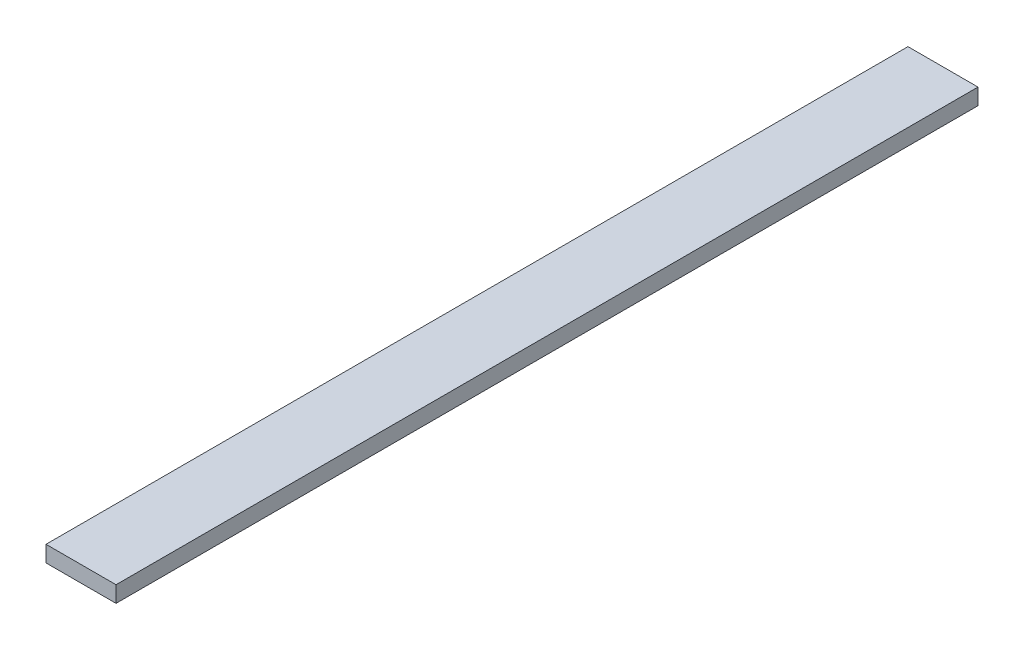
from build123d import *

# Parameters (mm, degrees)
SKETCH1_W           = 41.275
SKETCH1_H           = 9.525
BOSS_EXTRUDE1_DEPTH = 508


with BuildPart() as part:
    # Sketch1 → Boss-Extrude1 (new body)
    with BuildSketch(Plane.XY):
        with Locations((20.6375, 4.7625)):
            Rectangle(SKETCH1_W, SKETCH1_H)
    extrude(amount=BOSS_EXTRUDE1_DEPTH)


solid = part.part
